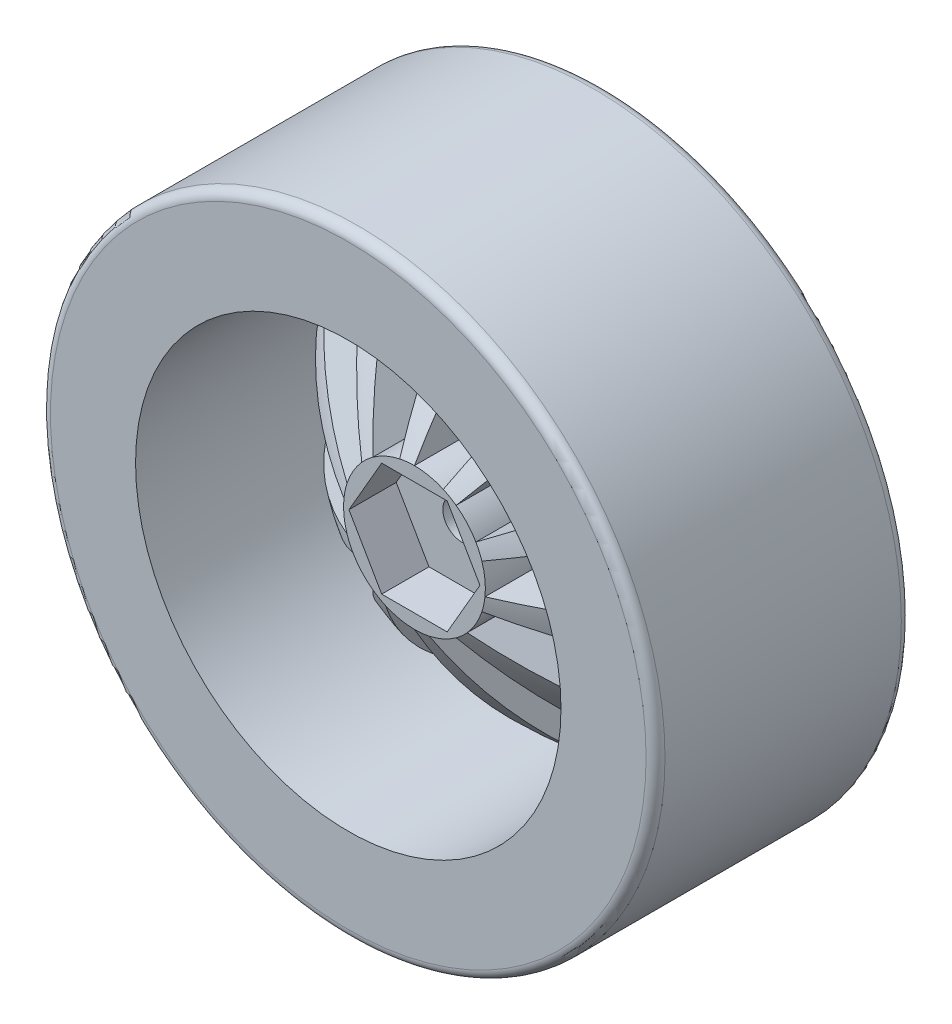
from build123d import *

# Parameters (mm, degrees)
SKETCH_1_R               = 7.5
EXTRUDE_1_DEPTH          = 5
EXTRUDE_START            = -3
SKETCH_2_R               = 7.5
SKETCH_2_R_2             = 2
EXTRUDE_2_DEPTH          = 3
EXTRUDE_3_DEPTH          = 12
EXTRUDE_3_DEPTH_BACK     = 15
SKETCH_3_R               = 32.5
SKETCH_3_R_2             = 22.5
REVOLVE_1_ANGLE          = 12
PATTERN_CIRCULAR_1_COUNT = 10
SKETCH_5_R               = 4.5
CUT_EXTRUDE_1_DEPTH      = 2
FILLET_1_R               = 1


with BuildPart() as part:
    # 草图1 → 凸台-拉伸1 (new body)
    with BuildSketch(Plane.XY):
        Circle(SKETCH_1_R)
        Polygon((-6.92820323, 0), (-3.464101615, -6), (3.464101615, -6), (6.92820323, 0), (3.464101615, 6), (-3.464101615, 6), align=None, mode=Mode.SUBTRACT)
    extrude(amount=EXTRUDE_1_DEPTH)

    # 草图2 → 凸台-拉伸2 (add)
    with BuildSketch(Plane.XY.offset(EXTRUDE_START)):
        Circle(SKETCH_2_R)
        Circle(SKETCH_2_R_2, mode=Mode.SUBTRACT)
    extrude(amount=EXTRUDE_2_DEPTH)



with BuildPart() as body_2:
    # 草图3 → 凸台-拉伸3 (new, two sides: drawn at the far end of the back side and taken through both)
    with BuildSketch(Plane.XY.offset(-EXTRUDE_3_DEPTH_BACK)):
        Circle(SKETCH_3_R)
        Circle(SKETCH_3_R_2, mode=Mode.SUBTRACT)
    extrude(amount=EXTRUDE_3_DEPTH + EXTRUDE_3_DEPTH_BACK)


with BuildPart() as part_1:
    add(part.part)

    add(body_2.part)  # 旋转1 merges body 2
    # 草图4 → 旋转1 (revolve)
    with BuildSketch(Plane(origin=(0, 0, 0), x_dir=(0, 0, -1), z_dir=(1, 0, 0))):
        with BuildLine():
            Line((-5, 7.5), (3, 7.5))
            ThreePointArc((3, 7.5), (7.415092079, 16.267926336), (15, 22.5))
            Line((15, 22.5), (7, 22.5))
            ThreePointArc((7, 22.5), (0.420622129, 15.463502297), (-5, 7.5))
        make_face()
    revolve_1 = revolve(axis=Axis((0, 0, -16.35), (0, 0, 1)), revolution_arc=REVOLVE_1_ANGLE)

    # 阵列(圆周)1: 旋转1 ×10 about axis
    pattern_circular_1_axis = Axis((0, 0, 0), (0, 0, 1))
    for i in range(1, PATTERN_CIRCULAR_1_COUNT):
        add(revolve_1.rotate(pattern_circular_1_axis, i * 360 / PATTERN_CIRCULAR_1_COUNT))

    # 草图5 → 切除-拉伸1 (cut)
    with BuildSketch(Plane(origin=(0, 0, -3), x_dir=(-1, 0, 0), z_dir=(0, 0, -1))):
        Circle(SKETCH_5_R)
    extrude(amount=-CUT_EXTRUDE_1_DEPTH, mode=Mode.SUBTRACT)

    # 圆角1
    fillet_1_edges = [part_1.edges().sort_by_distance(p)[0] for p in [
        (-32.5, 0, -15),
        (-32.5, 0, 12),
    ]]
    fillet(fillet_1_edges, radius=FILLET_1_R)


solid = part_1.part
